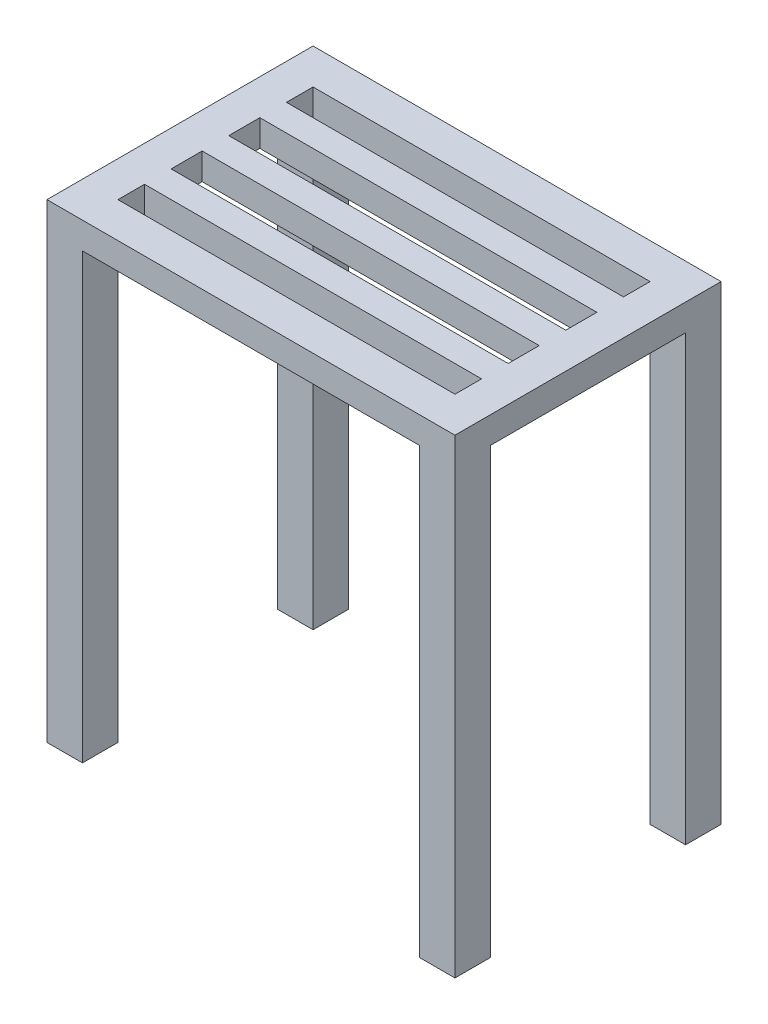
from build123d import *

# Parameters (mm, degrees)
SKETCH1_W             = 40
SKETCH1_H             = 40
BOSS_EXTRUDE1_DEPTH   = 500
BOSS_EXTRUDE1_2_DEPTH = 500
BOSS_EXTRUDE1_3_DEPTH = 500
BOSS_EXTRUDE1_4_DEPTH = 500
SKETCH2_W             = 460
SKETCH2_H             = 300
SKETCH2_W_2           = 380
SKETCH2_H_2           = 220
BOSS_EXTRUDE2_DEPTH   = 30
BOSS_EXTRUDE4_REACH   = 694.676
SKETCH4_W             = 30
SKETCH4_H             = 30


with BuildPart() as part:
    # Sketch1 → Boss-Extrude1 (new body)
    with BuildSketch(Plane(origin=(0, 0, 0), x_dir=(1, 0, 0), z_dir=(0, 1, 0))):
        with Locations((-210, 130)):
            Rectangle(SKETCH1_W, SKETCH1_H)
    extrude(amount=BOSS_EXTRUDE1_DEPTH)



with BuildPart() as body_2:
    # Sketch1 → Boss-Extrude1 2 (new body)
    with BuildSketch(Plane(origin=(0, 0, 0), x_dir=(1, 0, 0), z_dir=(0, 1, 0))):
        with Locations((-210, -130)):
            Rectangle(SKETCH1_W, SKETCH1_H)
    extrude(amount=BOSS_EXTRUDE1_2_DEPTH)


with BuildPart() as body_3:
    # Sketch1 → Boss-Extrude1 3 (new body)
    with BuildSketch(Plane(origin=(0, 0, 0), x_dir=(1, 0, 0), z_dir=(0, 1, 0))):
        with Locations((210, -130)):
            Rectangle(SKETCH1_W, SKETCH1_H)
    extrude(amount=BOSS_EXTRUDE1_3_DEPTH)


with BuildPart() as body_4:
    # Sketch1 → Boss-Extrude1 4 (new body)
    with BuildSketch(Plane(origin=(0, 0, 0), x_dir=(1, 0, 0), z_dir=(0, 1, 0))):
        with Locations((210, 130)):
            Rectangle(SKETCH1_W, SKETCH1_H)
    extrude(amount=BOSS_EXTRUDE1_4_DEPTH)


with BuildPart() as part_1:
    add(part.part)

    add(body_2.part)  # Boss-Extrude2 merges body 2

    add(body_3.part)  # Boss-Extrude2 merges body 3

    add(body_4.part)  # Boss-Extrude2 merges body 4
    # Sketch2 → Boss-Extrude2 (add)
    with BuildSketch(Plane(origin=(0, 500, 0), x_dir=(1, 0, 0), z_dir=(0, 1, 0))):
        Rectangle(SKETCH2_W, SKETCH2_H)
        Rectangle(SKETCH2_W_2, SKETCH2_H_2, mode=Mode.SUBTRACT)
    extrude(amount=BOSS_EXTRUDE2_DEPTH)

    # Sketch4 → Boss-Extrude4 (add, up to next)
    with BuildSketch(Plane(origin=(-190, 0, 0), x_dir=(0, 0, -1), z_dir=(1, 0, 0)), mode=Mode.PRIVATE) as boss_extrude4_sk1:
        with Locations((-65, 515)):
            Rectangle(SKETCH4_W, SKETCH4_H)
    boss_extrude4_tool1 = extrude(boss_extrude4_sk1.sketch, amount=BOSS_EXTRUDE4_REACH, mode=Mode.PRIVATE) - part_1.part
    # Sketch4 → Boss-Extrude4 (add, up to next)
    with BuildSketch(Plane(origin=(-190, 0, 0), x_dir=(0, 0, -1), z_dir=(1, 0, 0)), mode=Mode.PRIVATE) as boss_extrude4_sk2:
        with Locations((0, 515)):
            Rectangle(SKETCH4_W, SKETCH4_H)
    boss_extrude4_tool2 = extrude(boss_extrude4_sk2.sketch, amount=BOSS_EXTRUDE4_REACH, mode=Mode.PRIVATE) - part_1.part
    # Sketch4 → Boss-Extrude4 (add, up to next)
    with BuildSketch(Plane(origin=(-190, 0, 0), x_dir=(0, 0, -1), z_dir=(1, 0, 0)), mode=Mode.PRIVATE) as boss_extrude4_sk3:
        with Locations((65, 515)):
            Rectangle(SKETCH4_W, SKETCH4_H)
    boss_extrude4_tool3 = extrude(boss_extrude4_sk3.sketch, amount=BOSS_EXTRUDE4_REACH, mode=Mode.PRIVATE) - part_1.part
    add(boss_extrude4_tool1.solids().sort_by_distance((-190, 515, 65))[0])
    add(boss_extrude4_tool2.solids().sort_by_distance((-190, 515, 0))[0])
    add(boss_extrude4_tool3.solids().sort_by_distance((-190, 515, -65))[0])


solid = part_1.part
